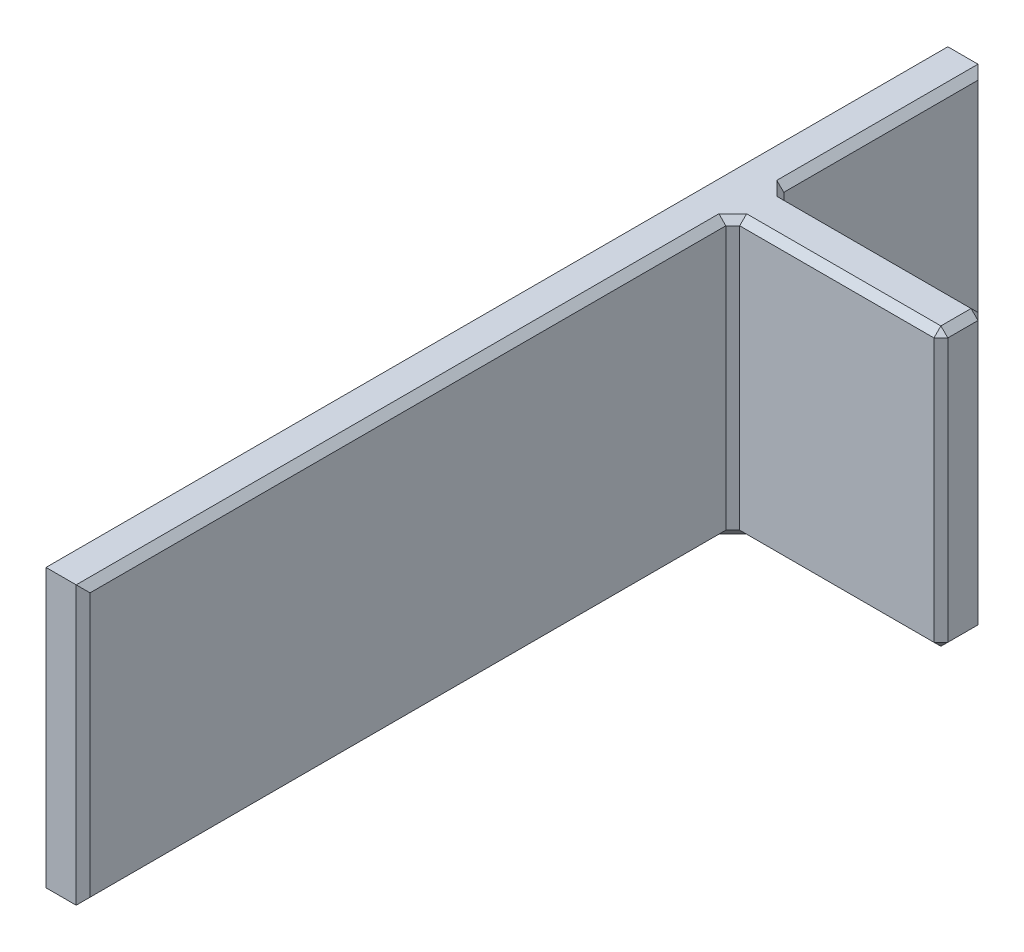
from build123d import *

# Parameters (mm, degrees)
CROQUIS1_W              = 6.35
CROQUIS1_H              = 40
SALIENTE_EXTRUIR1_DEPTH = 130
CROQUIS2_W              = 6.35
CROQUIS2_H              = 40
SALIENTE_EXTRUIR2_DEPTH = 30
CHAFL_N1_SIZE           = 1


with BuildPart() as part:
    # Croquis1 → Saliente-Extruir1 (new body)
    with BuildSketch(Plane.XY):
        Rectangle(CROQUIS1_W, CROQUIS1_H)
    extrude(amount=SALIENTE_EXTRUIR1_DEPTH)

    # Croquis2 → Saliente-Extruir2 (add)
    with BuildSketch(Plane(origin=(3.175, 0, 0), x_dir=(0, 0, -1), z_dir=(1, 0, 0))):
        with Locations((-33.175, 0)):
            Rectangle(CROQUIS2_W, CROQUIS2_H)
    extrude(amount=SALIENTE_EXTRUIR2_DEPTH)

    # Chaflán1
    chafl_n1_edges = [part.edges().sort_by_distance(p)[0] for p in [
        (3.175, 0, 130),
        (3.175, 20, 15),
        (3.175, -20, 15),
        (18.175, 20, 30),
        (3.175, 0, 36.35),
        (18.175, 20, 36.35),
        (18.175, -20, 36.35),
        (3.175, 0, 30),
        (18.175, -20, 30),
        (33.175, 20, 33.175),
        (33.175, 0, 36.35),
        (33.175, -20, 33.175),
        (33.175, 0, 30),
        (-3.175, 0, 130),
        (3.175, 0, 0),
        (-3.175, 0, 0),
        (-3.175, 20, 65),
        (3.175, 20, 83.175),
        (3.175, -20, 83.175),
        (-3.175, -20, 65),
    ]]
    chamfer(chafl_n1_edges, length=CHAFL_N1_SIZE)


solid = part.part
